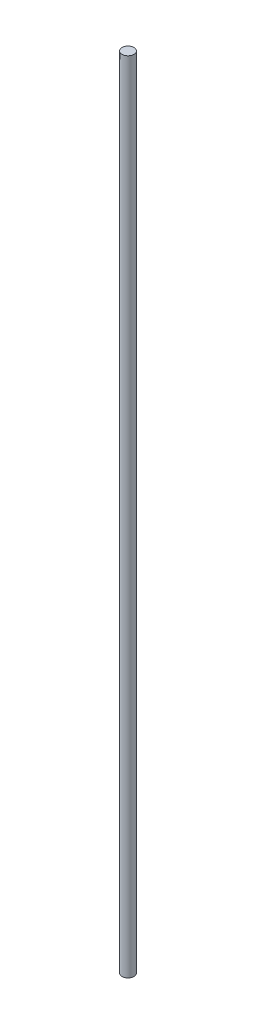
from build123d import *

# Parameters (mm, degrees)
SKETCH_1_R      = 1.5
EXTRUDE_1_DEPTH = 200


with BuildPart() as part:
    # 草图1 → 凸台-拉伸1 (new body)
    with BuildSketch(Plane(origin=(0, 0, 0), x_dir=(1, 0, 0), z_dir=(0, 1, 0))):
        with Locations(Location((0, 0, 0), (0, 0, 270))):
            Circle(SKETCH_1_R)
    extrude(amount=EXTRUDE_1_DEPTH)


solid = part.part
